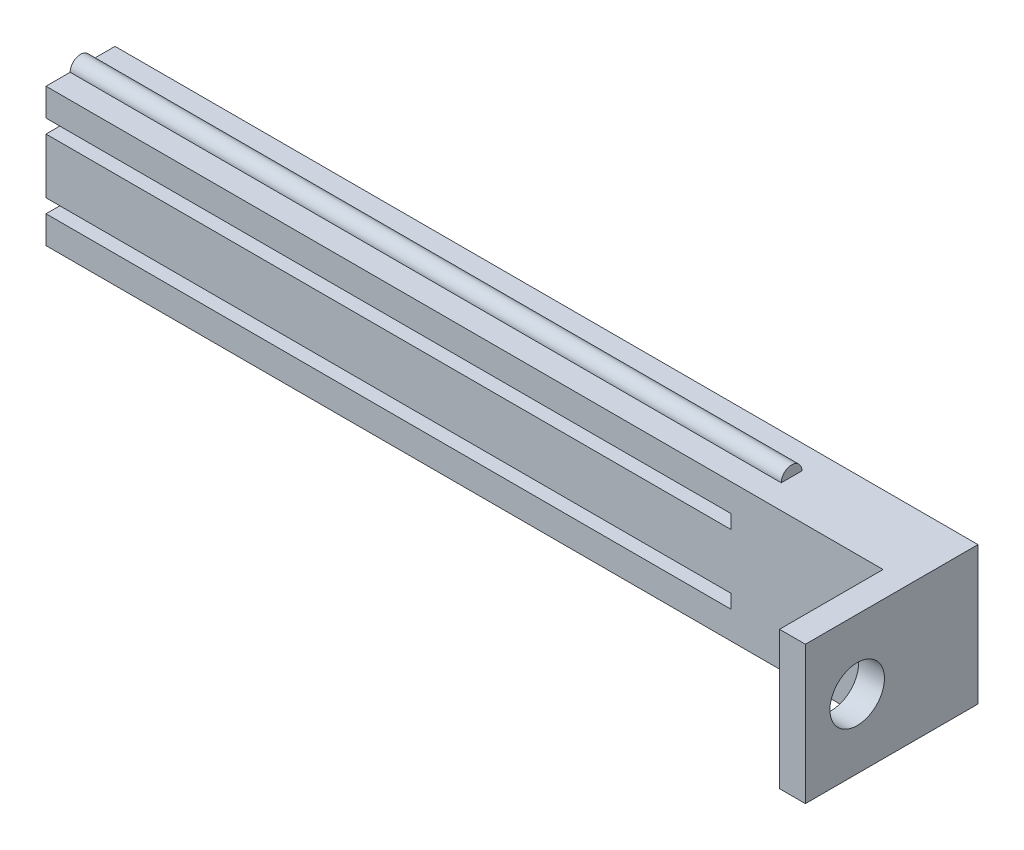
from build123d import *

# Parameters (mm, degrees)
SKETCH1_W           = 250
SKETCH1_H           = 40
BOSS_EXTRUDE1_DEPTH = 20
SKETCH2_W           = 7.5
SKETCH2_H           = 40
BOSS_EXTRUDE2_DEPTH = 30
BOSS_EXTRUDE3_DEPTH = 206
CUT_EXTRUDE1_DEPTH  = 198.5
SKETCH7_R           = 7.9
CUT_EXTRUDE2_DEPTH  = 258.764157926


with BuildPart() as part:
    # Sketch1 → Boss-Extrude1 (new body)
    with BuildSketch(Plane.XY):
        with Locations((-22.278734849, 48.666666667)):
            Rectangle(SKETCH1_W, SKETCH1_H)
    extrude(amount=BOSS_EXTRUDE1_DEPTH)

    # Sketch2 → Boss-Extrude2 (add)
    with BuildSketch(Plane.XY.offset(20)):
        with Locations((98.971265151, 48.666666667)):
            Rectangle(SKETCH2_W, SKETCH2_H)
    extrude(amount=BOSS_EXTRUDE2_DEPTH)

    # Sketch4 → Boss-Extrude3 (add)
    with BuildSketch(Plane.ZY.offset(147.278734849)):
        with BuildLine():
            Line((7, 68.666666667), (13, 68.666666667))
            ThreePointArc((13, 68.666666667), (10, 71.666666667), (7, 68.666666667))
        make_face()
        with BuildLine():
            Line((7, 28.666666667), (13, 28.666666667))
            ThreePointArc((13, 28.666666667), (10, 25.666666667), (7, 28.666666667))
        make_face()
    extrude(amount=-BOSS_EXTRUDE3_DEPTH)

    # Sketch6 → Cut-Extrude1 (cut)
    with BuildSketch(Plane.ZY.offset(147.278734849)):
        Polygon((20, 56.666666667), (20, 60.666666667), (15, 60.666666667), (15, 63.666666667), (10, 63.666666667), (10, 53.666666667), (15, 53.666666667), (15, 56.666666667), align=None)
        Polygon((20, 36.666666667), (20, 40.666666667), (15, 40.666666667), (15, 43.666666667), (10, 43.666666667), (10, 33.666666667), (15, 33.666666667), (15, 36.666666667), align=None)
    extrude(amount=-CUT_EXTRUDE1_DEPTH, mode=Mode.SUBTRACT)

    # Sketch7 → Cut-Extrude2 (cut, through all)
    with BuildSketch(Plane.ZY.offset(-95.221265151)):
        with Locations(Location((35, 48.666666667, 0), (0, 0, 270))):
            Circle(SKETCH7_R)
    extrude(amount=-CUT_EXTRUDE2_DEPTH, mode=Mode.SUBTRACT)


solid = part.part
